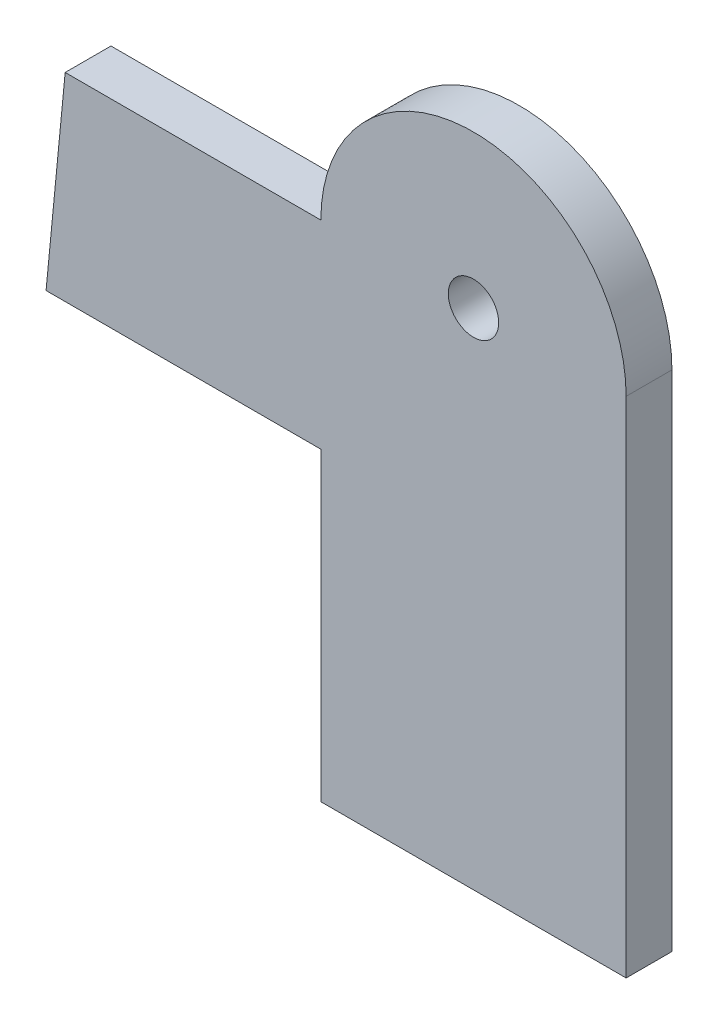
from build123d import *

# Parameters (mm, degrees)
SKETCH_1_R      = 1.65
EXTRUDE_1_DEPTH = 3
EXTRUDE_2_DEPTH = 3


with BuildPart() as part:
    # 草图1 → 凸台-拉伸1 (new body)
    with BuildSketch(Plane.XY):
        with BuildLine():
            Line((0, 0), (20, 0))
            Line((20, 0), (20, 33))
            ThreePointArc((20, 33), (10, 43), (0, 33))
            Line((0, 33), (0, 0))
        make_face()
        with Locations((10, 33)):
            Circle(SKETCH_1_R, mode=Mode.SUBTRACT)
    extrude(amount=EXTRUDE_1_DEPTH)

    # 草图5 → 凸台-拉伸2 (add)
    with BuildSketch(Plane(origin=(0, 0, 0), x_dir=(-1, 0, 0), z_dir=(0, 0, -1))):
        Polygon((0, 33), (0, 20), (18, 20), (16.748242373, 33), align=None)
    extrude(amount=-EXTRUDE_2_DEPTH)


solid = part.part
